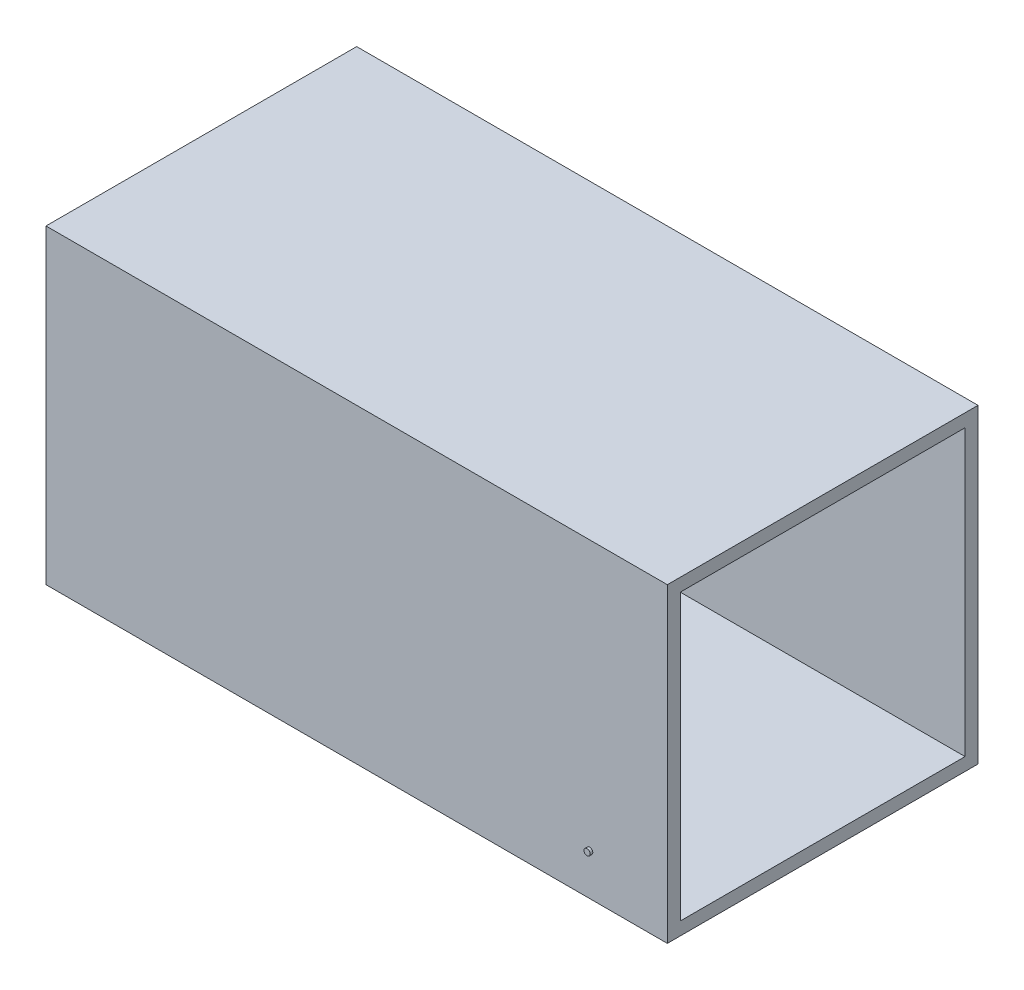
from build123d import *

# Parameters (mm, degrees)
SKETCH1_W           = 600
SKETCH1_H           = 600
BOSS_EXTRUDE1_DEPTH = 1200
SHELL1_T            = -25
SKETCH2_R           = 6
BOSS_EXTRUDE2_DEPTH = 5


with BuildPart() as part:
    # Sketch1 → Boss-Extrude1 (new body)
    with BuildSketch(Plane(origin=(0, 0, 0), x_dir=(0, 0, -1), z_dir=(1, 0, 0))):
        with Locations((300, 300)):
            Rectangle(SKETCH1_W, SKETCH1_H)
    extrude(amount=BOSS_EXTRUDE1_DEPTH)

    # Shell1
    shell1_openings = [part.faces().sort_by_distance(p)[0] for p in [
        (1200, 300, -300),
    ]]
    offset(amount=SHELL1_T, openings=shell1_openings, kind=Kind.INTERSECTION)

    # Sketch2 → Boss-Extrude2 (add)
    with BuildSketch(Plane.XY):
        with Locations(Location((1050, 80, 0), (0, 0, 180))):
            Circle(SKETCH2_R)
    boss_extrude2 = extrude(amount=BOSS_EXTRUDE2_DEPTH)

    # Mirror1: Boss-Extrude2 across plane
    add(boss_extrude2.mirror(Plane.XY.offset(-300)))


solid = part.part
